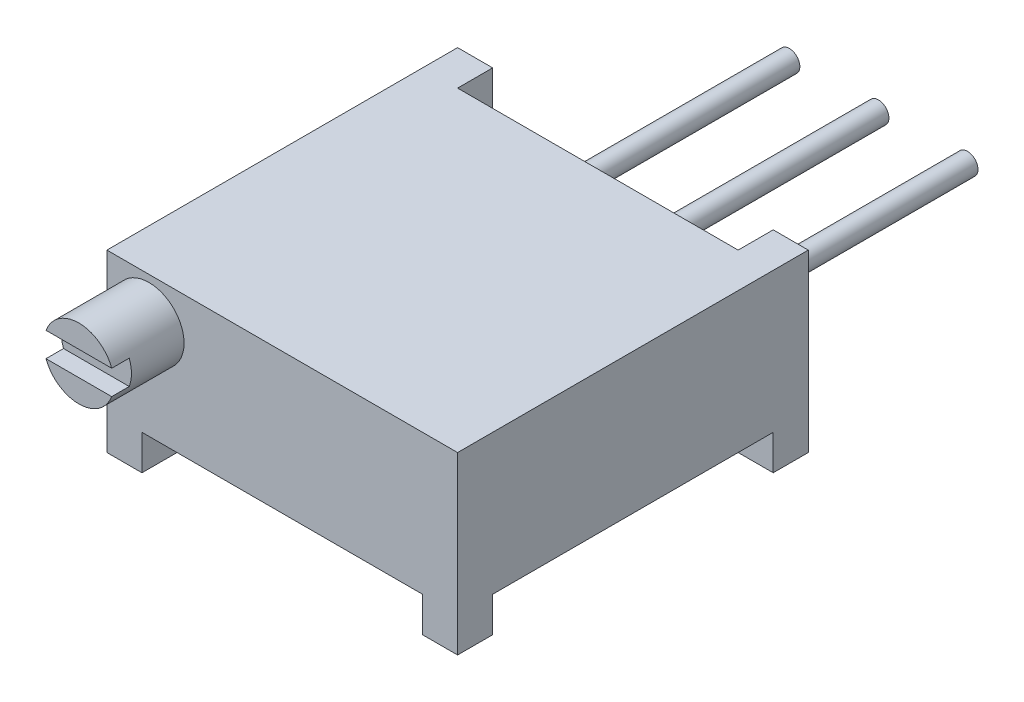
from build123d import *
from build123d.topology import SkipClean

# Parameters (mm, degrees)
SKETCH_1_W          = 5
SKETCH_1_H          = 10
EXTRUDE_1_DEPTH     = 1
SKETCH_2_W          = 9
SKETCH_2_H          = 1
CUT_EXTRUDE_1_DEPTH = 11.378251298
SKETCH_3_W          = 9
SKETCH_3_H          = 4
EXTRUDE_2_DEPTH     = 9
SKETCH_4_W          = 1
SKETCH_4_H          = 4
EXTRUDE_3_DEPTH     = 1
SKETCH_5_W          = 1
SKETCH_5_H          = 1
EXTRUDE_4_DEPTH     = 1
SKETCH_6_W          = 1
SKETCH_6_H          = 1
EXTRUDE_5_DEPTH     = 1
SKETCH_7_W          = 1
SKETCH_7_H          = 1
EXTRUDE_6_DEPTH     = 1
SKETCH_8_R          = 1
EXTRUDE_7_DEPTH     = 2
CUT_EXTRUDE_START   = -0.5
CUT_EXTRUDE_2_DEPTH = 0.5
EXTRUDE_8_DEPTH     = 0.5
SKETCH_11_R         = 0.3
EXTRUDE_9_DEPTH     = 8
SKETCH_12_R         = 0.3
EXTRUDE_10_DEPTH    = 8
SKETCH_13_R         = 0.3
EXTRUDE_11_DEPTH    = 8


with BuildPart() as part:
    # Эскиз1 → Бобышка-Вытянуть1 (new body)
    with BuildSketch(Plane(origin=(-5, 0, 0), x_dir=(0, -1, 0), z_dir=(-1, 0, 0))):
        with Locations((-0.09, 5)):
            Rectangle(SKETCH_1_W, SKETCH_1_H)
    extrude(amount=-EXTRUDE_1_DEPTH)

    # Эскиз2 → Вырез-Вытянуть1 (cut, through all)
    with BuildSketch(Plane(origin=(-4, 0, 0), x_dir=(0, 0, -1), z_dir=(1, 0, 0))):
        with Locations((-5.5, -1.91)):
            Rectangle(SKETCH_2_W, SKETCH_2_H)
    extrude(amount=-CUT_EXTRUDE_1_DEPTH, mode=Mode.SUBTRACT)

    # Эскиз3 → Бобышка-Вытянуть2 (add)
    with BuildSketch(Plane(origin=(-4, 0, 0), x_dir=(0, 0, -1), z_dir=(1, 0, 0))):
        with Locations((-5.5, 0.59)):
            Rectangle(SKETCH_3_W, SKETCH_3_H)
    extrude(amount=EXTRUDE_2_DEPTH)

    # Эскиз4 → Бобышка-Вытянуть3 (add)
    with BuildSketch(Plane(origin=(0, 0, 1), x_dir=(-1, 0, 0), z_dir=(0, 0, -1))):
        with Locations((-4.5, 0.59)):
            Rectangle(SKETCH_4_W, SKETCH_4_H)
    extrude(amount=EXTRUDE_3_DEPTH)

    # Эскиз5 → Бобышка-Вытянуть4 (add)
    with BuildSketch(Plane.XZ.offset(1.41)):
        with Locations((4.5, 0.5)):
            Rectangle(SKETCH_5_W, SKETCH_5_H)
    extrude(amount=EXTRUDE_4_DEPTH)

    # Эскиз6 → Бобышка-Вытянуть5 (add)
    with BuildSketch(Plane.XZ.offset(1.41)):
        with Locations((-4.5, 9.5)):
            Rectangle(SKETCH_6_W, SKETCH_6_H)
    extrude(amount=EXTRUDE_5_DEPTH)

    # Эскиз7 → Бобышка-Вытянуть6 (add)
    with BuildSketch(Plane.XZ.offset(1.41)):
        with Locations((4.5, 9.5)):
            Rectangle(SKETCH_7_W, SKETCH_7_H)
    extrude(amount=EXTRUDE_6_DEPTH)

    # Эскиз8 → Бобышка-Вытянуть7 (add)
    with BuildSketch(Plane.XY.offset(10)):
        with Locations((-3.8, 1.39)):
            Circle(SKETCH_8_R)
    extrude(amount=EXTRUDE_7_DEPTH)

    # Эскиз9 → Вырез-Вытянуть2 (cut)
    with BuildSketch(Plane.XY.offset(12).offset(CUT_EXTRUDE_START)):
        with BuildLine():
            Line((-4.7367497, 1.04), (-2.8632503, 1.04))
            ThreePointArc((-2.8632503, 1.04), (-3.8, 2.39), (-4.7367497, 1.04))
        make_face()
    extrude(amount=CUT_EXTRUDE_2_DEPTH, mode=Mode.SUBTRACT)

    # Эскиз10 → Бобышка-Вытянуть8 (add)
    with SkipClean():  # the faces are left unmerged after this step: merging them gives an invalid solid
        with BuildSketch(Plane.XY.offset(11.5)):
            with BuildLine():
                Line((-2.8632503, 1.74), (-4.7367497, 1.74))
                ThreePointArc((-4.7367497, 1.74), (-3.8, 2.39), (-2.8632503, 1.74))
            make_face()
        extrude(amount=EXTRUDE_8_DEPTH)

    # Эскиз11 → Бобышка-Вытянуть9 (add)
    with SkipClean():  # the faces are left unmerged after this step: merging them gives an invalid solid
        with BuildSketch(Plane(origin=(0, 0, 1), x_dir=(-1, 0, 0), z_dir=(0, 0, -1))):
            with Locations(Location((-2.54, 0, 0), (0, 0, 180))):
                Circle(SKETCH_11_R)
        extrude(amount=EXTRUDE_9_DEPTH)

    # Эскиз12 → Бобышка-Вытянуть10 (add)
    with SkipClean():  # the faces are left unmerged after this step: merging them gives an invalid solid
        with BuildSketch(Plane(origin=(0, 0, 1), x_dir=(-1, 0, 0), z_dir=(0, 0, -1))):
            with Locations(Location((0, 0, 0), (0, 0, 180))):
                Circle(SKETCH_12_R)
        extrude(amount=EXTRUDE_10_DEPTH)

    # Эскиз13 → Бобышка-Вытянуть11 (add)
    with SkipClean():  # the faces are left unmerged after this step: merging them gives an invalid solid
        with BuildSketch(Plane(origin=(0, 0, 1), x_dir=(-1, 0, 0), z_dir=(0, 0, -1))):
            with Locations(Location((2.54, 0, 0), (0, 0, 180))):
                Circle(SKETCH_13_R)
        extrude(amount=EXTRUDE_11_DEPTH)


solid = part.part
